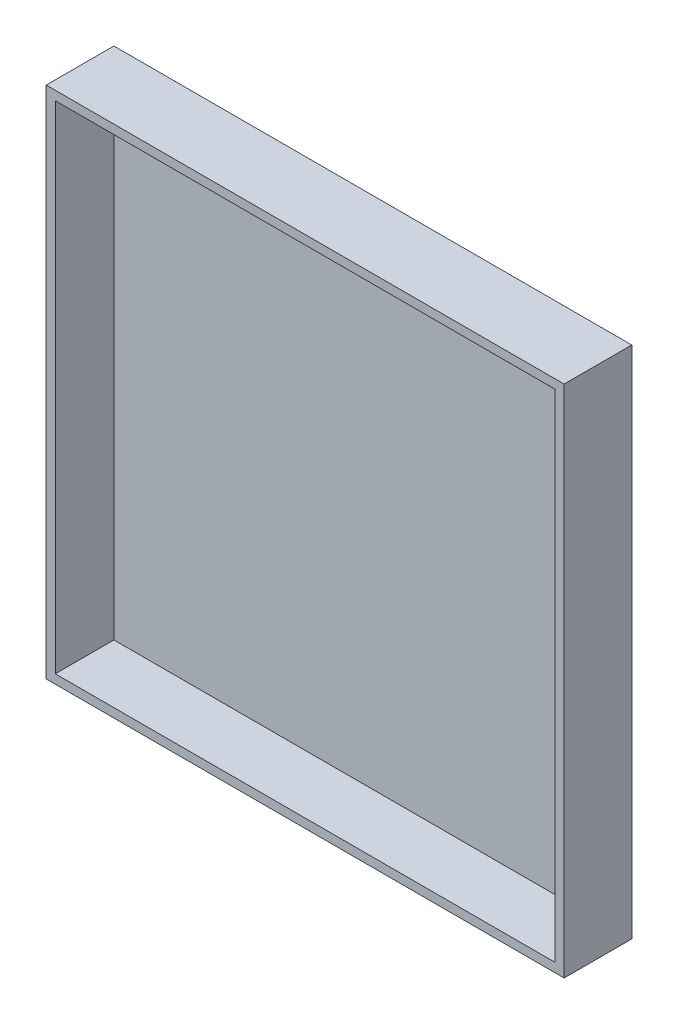
from build123d import *

# Parameters (mm, degrees)
SKICA1_W                 = 114.835
SKICA1_H                 = 114.06
P_IDAT_VYSUNUT_M1_DEPTH  = 15
SKICA2_W                 = 110.835
SKICA2_H                 = 110.06
ODEBRAT_VYSUNUT_M1_DEPTH = 13


with BuildPart() as part:
    # Skica1 → Přidat vysunutím1 (new body)
    with BuildSketch(Plane.XY):
        with Locations((-53.4175, 57.03)):
            Rectangle(SKICA1_W, SKICA1_H)
    extrude(amount=P_IDAT_VYSUNUT_M1_DEPTH)

    # Skica2 → Odebrat vysunutím1 (cut)
    with BuildSketch(Plane.XY.offset(15)):
        with Locations((-53.4175, 57.03)):
            Rectangle(SKICA2_W, SKICA2_H)
    extrude(amount=-ODEBRAT_VYSUNUT_M1_DEPTH, mode=Mode.SUBTRACT)


solid = part.part
